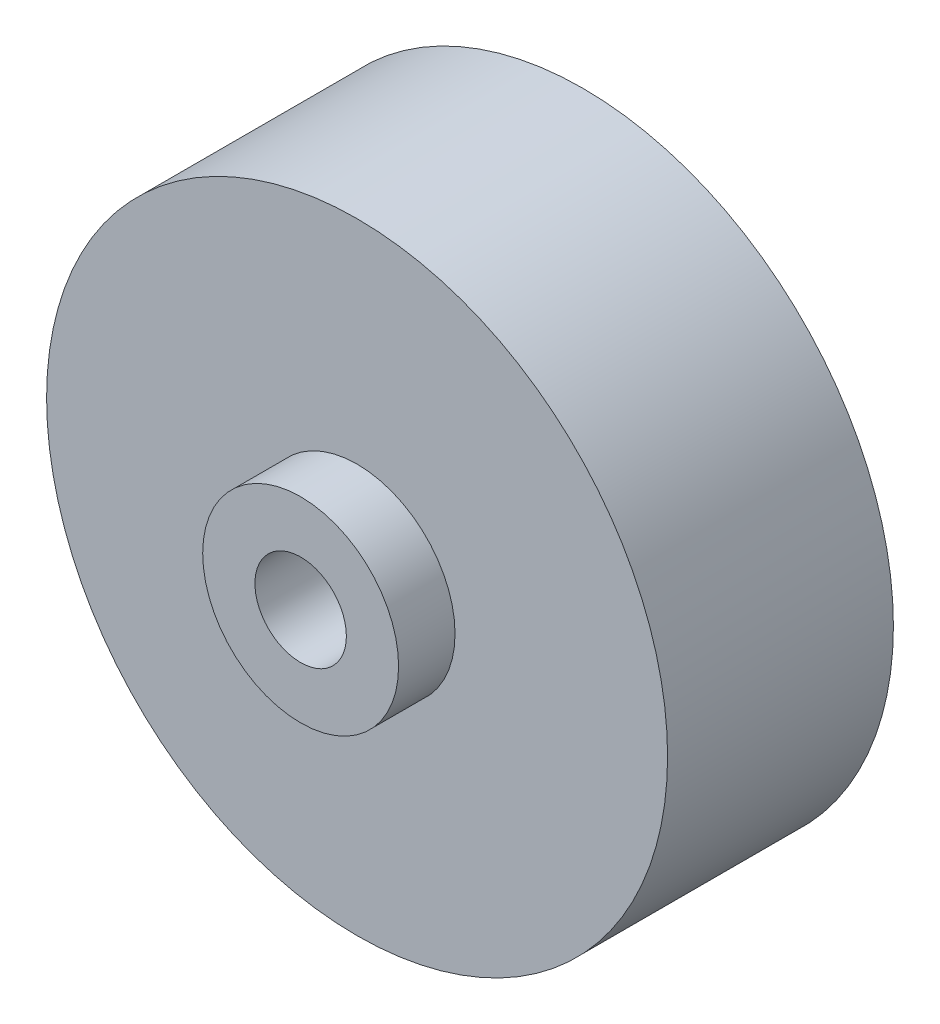
from build123d import *

# Parameters (mm, degrees)
CROQUIS1_R              = 27.5
SALIENTE_EXTRUIR1_DEPTH = 10
CROQUIS4_R              = 4.05
CORTAR_EXTRUIR2_DEPTH   = 108
CROQUIS5_R              = 8.675
SALIENTE_EXTRUIR2_DEPTH = 5
CROQUIS6_R              = 4.05
CORTAR_EXTRUIR3_DEPTH   = 122


with BuildPart() as part:
    # Croquis1 → Saliente-Extruir1 (new, symmetric)
    with BuildSketch(Plane.XY):
        Circle(CROQUIS1_R)
    extrude(amount=SALIENTE_EXTRUIR1_DEPTH, both=True)

    # Croquis4 → Cortar-Extruir2 (cut)
    with BuildSketch(Plane.XY.offset(10)):
        Circle(CROQUIS4_R)
    extrude(amount=-CORTAR_EXTRUIR2_DEPTH, mode=Mode.SUBTRACT)

    # Croquis5 → Saliente-Extruir2 (add)
    with BuildSketch(Plane.XY.offset(10)):
        Circle(CROQUIS5_R)
    extrude(amount=SALIENTE_EXTRUIR2_DEPTH)

    # Croquis6 → Cortar-Extruir3 (cut, symmetric)
    with BuildSketch(Plane.XY.offset(15)):
        Circle(CROQUIS6_R)
    extrude(amount=CORTAR_EXTRUIR3_DEPTH, both=True, mode=Mode.SUBTRACT)


solid = part.part
